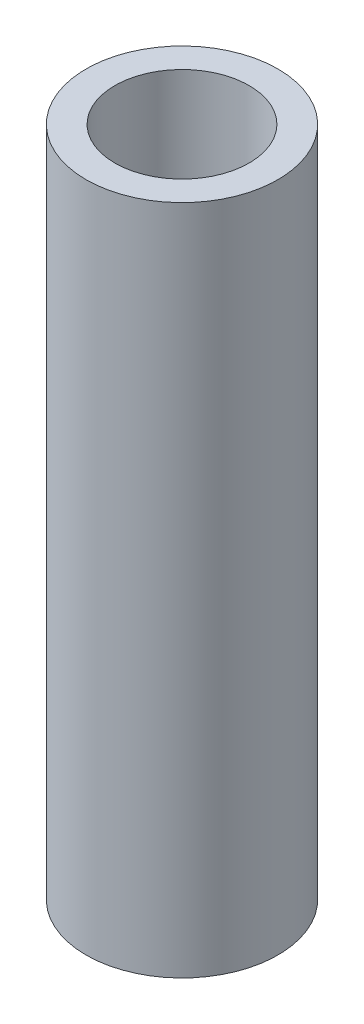
from build123d import *

# Parameters (mm, degrees)
FEED_TUBE_SKETCH_R   = 10
FEED_TUBE_SKETCH_R_2 = 7
FEED_TUBE_DEPTH      = 70


with BuildPart() as part:
    # Feed Tube Sketch → Feed Tube (new body)
    with BuildSketch(Plane(origin=(0, 0, 0), x_dir=(1, 0, 0), z_dir=(0, 1, 0))):
        with Locations(Location((0, 0, 0), (0, 0, 270))):
            Circle(FEED_TUBE_SKETCH_R)
        with Locations(Location((0, 0, 0), (0, 0, 270))):
            Circle(FEED_TUBE_SKETCH_R_2, mode=Mode.SUBTRACT)
    extrude(amount=FEED_TUBE_DEPTH)


solid = part.part
